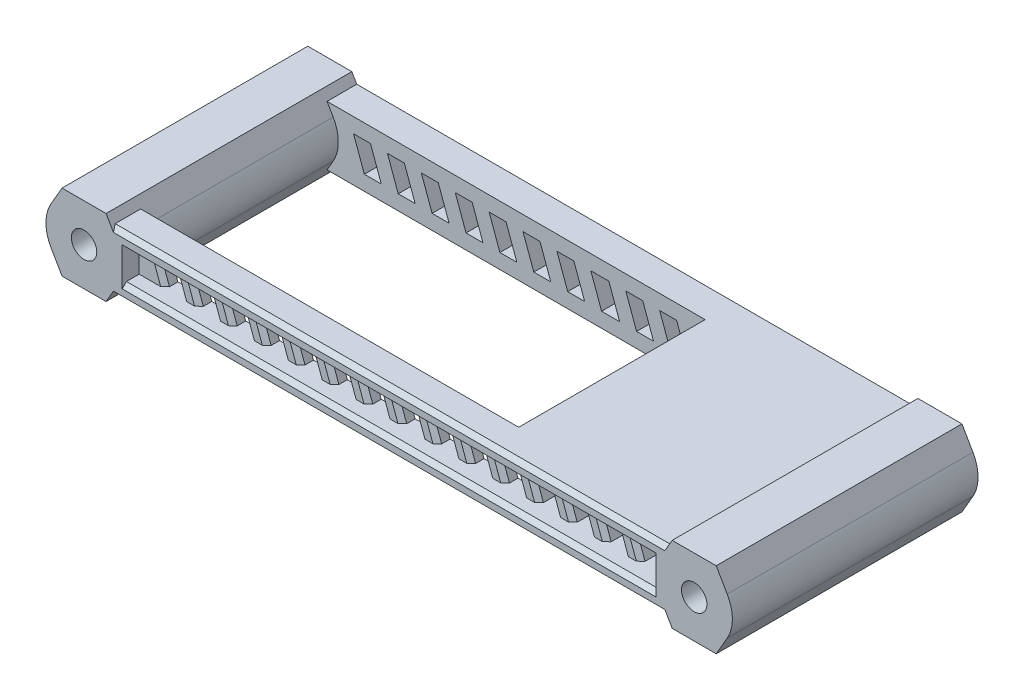
from build123d import *

# Parameters (mm, degrees)
SKETCH2_R           = 1.5
BOSS_EXTRUDE1_DEPTH = 27
SKETCH3_R           = 1.5
SKETCH3_W           = 63
SKETCH3_H           = 3.5
BOSS_EXTRUDE2_DEPTH = 2
CHAMFER1_SIZE       = 0.5
CUT_EXTRUDE1_DEPTH  = 11


with BuildPart() as part:
    # Sketch2 → Boss-Extrude1 (new body)
    with BuildSketch(Plane.XY):
        with BuildLine():
            Line((32.824573519, -3.5), (-32.824573519, -3.5))
            Line((-32.824573519, -3.5), (-33.401923789, -4.5))
            Line((-33.401923789, -4.5), (-38.598076211, -4.5))
            Line((-38.598076211, -4.5), (-39.897114317, -2.25))
            ThreePointArc((-39.897114317, -2.25), (-40.5, 0), (-39.897114317, 2.25))
            Line((-39.897114317, 2.25), (-38.598076211, 4.5))
            Line((-38.598076211, 4.5), (-33.401923789, 4.5))
            Line((-33.401923789, 4.5), (-32.824573519, 3.5))
            Line((-32.824573519, 3.5), (32.824573519, 3.5))
            Line((32.824573519, 3.5), (33.401923789, 4.5))
            Line((33.401923789, 4.5), (38.598076211, 4.5))
            Line((38.598076211, 4.5), (39.897114317, 2.25))
            ThreePointArc((39.897114317, 2.25), (40.5, 0), (39.897114317, -2.25))
            Line((39.897114317, -2.25), (38.598076211, -4.5))
            Line((38.598076211, -4.5), (33.401923789, -4.5))
            Line((33.401923789, -4.5), (32.824573519, -3.5))
        make_face()
        with Locations((-36, 0)):
            Circle(SKETCH2_R, mode=Mode.SUBTRACT)
        with Locations((36, 0)):
            Circle(SKETCH2_R, mode=Mode.SUBTRACT)
        Polygon((-27.701125682, 1.75), (-26.427229863, -1.75), (-28.427229863, -1.75), (-29.701125682, 1.75), align=None, mode=Mode.SUBTRACT)
        Polygon((-25.701125682, 1.75), (-24.427229863, -1.75), (-22.427229863, -1.75), (-23.701125682, 1.75), align=None, mode=Mode.SUBTRACT)
        Polygon((-21.701125682, 1.75), (-20.427229863, -1.75), (-18.427229863, -1.75), (-19.701125682, 1.75), align=None, mode=Mode.SUBTRACT)
        Polygon((-17.701125682, 1.75), (-16.427229863, -1.75), (-14.427229863, -1.75), (-15.701125682, 1.75), align=None, mode=Mode.SUBTRACT)
        Polygon((-13.701125682, 1.75), (-12.427229863, -1.75), (-10.427229863, -1.75), (-11.701125682, 1.75), align=None, mode=Mode.SUBTRACT)
        Polygon((-9.701125682, 1.75), (-8.427229863, -1.75), (-6.427229863, -1.75), (-7.701125682, 1.75), align=None, mode=Mode.SUBTRACT)
        Polygon((-5.701125682, 1.75), (-4.427229863, -1.75), (-2.427229863, -1.75), (-3.701125682, 1.75), align=None, mode=Mode.SUBTRACT)
        Polygon((-1.701125682, 1.75), (-0.427229863, -1.75), (1.701125682, -1.75), (0.427229863, 1.75), align=None, mode=Mode.SUBTRACT)
        Polygon((2.427229863, 1.75), (3.701125682, -1.75), (5.701125682, -1.75), (4.427229863, 1.75), align=None, mode=Mode.SUBTRACT)
        Polygon((6.427229863, 1.75), (7.701125682, -1.75), (9.701125682, -1.75), (8.427229863, 1.75), align=None, mode=Mode.SUBTRACT)
        Polygon((10.427229863, 1.75), (11.701125682, -1.75), (13.701125682, -1.75), (12.427229863, 1.75), align=None, mode=Mode.SUBTRACT)
        Polygon((14.427229863, 1.75), (15.701125682, -1.75), (17.701125682, -1.75), (16.427229863, 1.75), align=None, mode=Mode.SUBTRACT)
        Polygon((18.427229863, 1.75), (19.701125682, -1.75), (21.701125682, -1.75), (20.427229863, 1.75), align=None, mode=Mode.SUBTRACT)
        Polygon((22.427229863, 1.75), (23.701125682, -1.75), (25.701125682, -1.75), (24.427229863, 1.75), align=None, mode=Mode.SUBTRACT)
        Polygon((26.427229863, 1.75), (27.701125682, -1.75), (29.701125682, -1.75), (28.427229863, 1.75), align=None, mode=Mode.SUBTRACT)
    extrude(amount=BOSS_EXTRUDE1_DEPTH)

    # Sketch3 → Boss-Extrude2 (add)
    with BuildSketch(Plane.XY.offset(27)):
        with BuildLine():
            Line((-39.897114317, -2.25), (-38.598076211, -4.5))
            Line((-38.598076211, -4.5), (-33.401923789, -4.5))
            Line((-33.401923789, -4.5), (-32.824573519, -3.5))
            Line((-32.824573519, -3.5), (32.824573519, -3.5))
            Line((32.824573519, -3.5), (33.401923789, -4.5))
            Line((33.401923789, -4.5), (38.598076211, -4.5))
            Line((38.598076211, -4.5), (39.897114317, -2.25))
            ThreePointArc((39.897114317, -2.25), (40.5, 0), (39.897114317, 2.25))
            Line((39.897114317, 2.25), (38.598076211, 4.5))
            Line((38.598076211, 4.5), (33.401923789, 4.5))
            Line((33.401923789, 4.5), (32.824573519, 3.5))
            Line((32.824573519, 3.5), (-32.824573519, 3.5))
            Line((-32.824573519, 3.5), (-33.401923789, 4.5))
            Line((-33.401923789, 4.5), (-38.598076211, 4.5))
            Line((-38.598076211, 4.5), (-39.897114317, 2.25))
            ThreePointArc((-39.897114317, 2.25), (-40.5, 0), (-39.897114317, -2.25))
        make_face()
        with Locations((-36, 0)):
            Circle(SKETCH3_R, mode=Mode.SUBTRACT)
        with Locations((36, 0)):
            Circle(SKETCH3_R, mode=Mode.SUBTRACT)
        Rectangle(SKETCH3_W, SKETCH3_H, mode=Mode.SUBTRACT)
    extrude(amount=BOSS_EXTRUDE2_DEPTH)

    # Chamfer1
    chamfer1_edges = [part.edges().sort_by_distance(p)[0] for p in [
        (-9.064177772, 0, 27),
        (-7.064177772, 0, 27),
        (-5.064177772, 0, 27),
        (-3.064177772, 0, 27),
        (-1.064177772, 0, 27),
        (1.064177772, 0, 27),
        (3.064177772, 0, 27),
        (5.064177772, 0, 27),
        (7.064177772, 0, 27),
        (9.064177772, 0, 27),
        (11.064177772, 0, 27),
        (13.064177772, 0, 27),
        (15.064177772, 0, 27),
        (17.064177772, 0, 27),
        (19.064177772, 0, 27),
        (21.064177772, 0, 27),
        (23.064177772, 0, 27),
        (25.064177772, 0, 27),
        (27.064177772, 0, 27),
        (29.064177772, 0, 27),
        (0, -3.5, 29),
        (0, 3.5, 29),
        (0, 1.75, 29),
        (0, -1.75, 29),
        (-29.064177772, 0, 27),
        (-27.064177772, 0, 27),
        (-25.064177772, 0, 27),
        (-23.064177772, 0, 27),
        (-21.064177772, 0, 27),
        (-19.064177772, 0, 27),
        (-17.064177772, 0, 27),
        (-15.064177772, 0, 27),
        (-13.064177772, 0, 27),
        (-11.064177772, 0, 27),
    ]]
    chamfer(chamfer1_edges, length=CHAMFER1_SIZE)

    # Sketch4 → Cut-Extrude1 (cut, symmetric)
    with BuildSketch(Plane.XY.offset(14.5)):
        with BuildLine():
            Line((-33.401923789, 4.5), (-34.844518305, 6.998646998))
            Line((-34.844518305, 6.998646998), (10.516878585, 6.998646998))
            Line((10.516878585, 6.998646998), (12.427229863, 1.75))
            Line((12.427229863, 1.75), (13.701125682, -1.75))
            Line((13.701125682, -1.75), (15.61147696, -6.998646998))
            Line((15.61147696, -6.998646998), (-34.844518305, -6.998646998))
            Line((-34.844518305, -6.998646998), (-33.401923789, -4.5))
            Line((-33.401923789, -4.5), (-32.102885683, -2.25))
            ThreePointArc((-32.102885683, -2.25), (-31.5, 0), (-32.102885683, 2.25))
            Line((-32.102885683, 2.25), (-33.401923789, 4.5))
        make_face()
    extrude(amount=CUT_EXTRUDE1_DEPTH, both=True, mode=Mode.SUBTRACT)


solid = part.part
